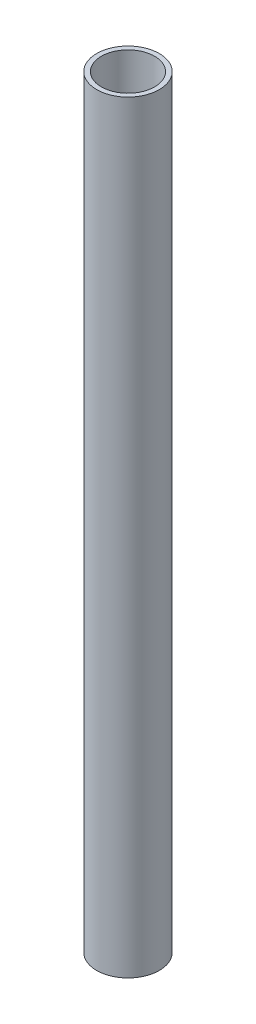
from build123d import *

# Parameters (mm, degrees)
SKETCH_1_R      = 16
SKETCH_1_R_2    = 13.6
EXTRUDE_1_DEPTH = 390


with BuildPart() as part:
    # 草图1 → 凸台-拉伸1 (new body)
    with BuildSketch(Plane(origin=(0, 0, 0), x_dir=(1, 0, 0), z_dir=(0, 1, 0))):
        with Locations(Location((0, 0, 0), (0, 0, 270))):
            Circle(SKETCH_1_R)
        with Locations(Location((0, 0, 0), (0, 0, 270))):
            Circle(SKETCH_1_R_2, mode=Mode.SUBTRACT)
    extrude(amount=EXTRUDE_1_DEPTH)


solid = part.part
